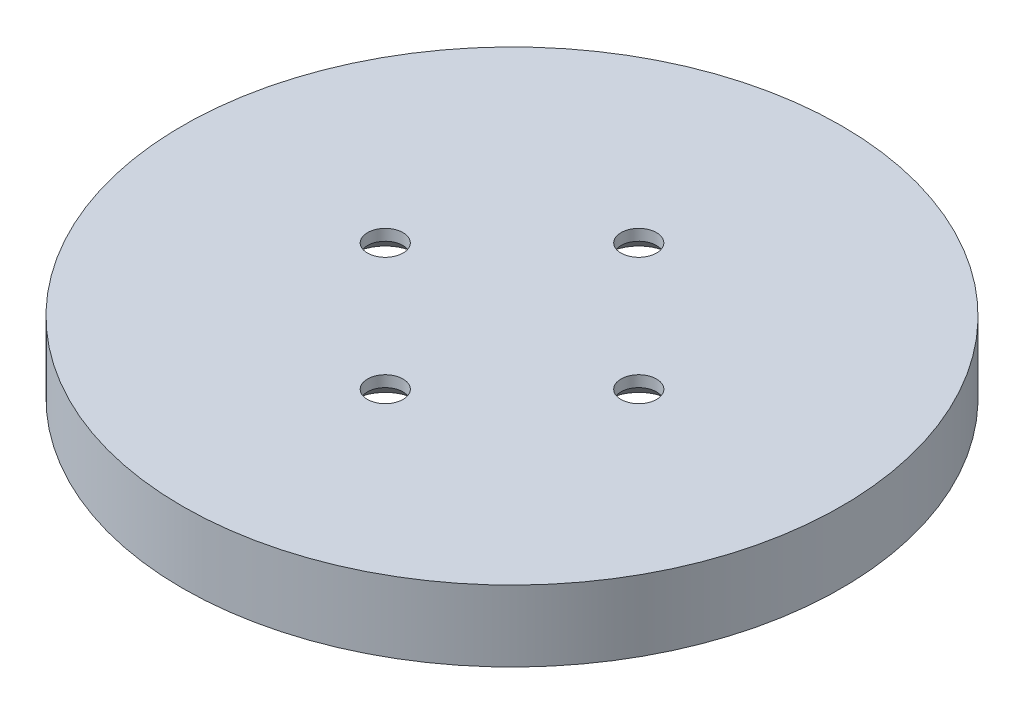
from build123d import *

# Parameters (mm, degrees)
SKETCH1_R                                    = 65
BOSS_EXTRUDE2_DEPTH                          = 30
SKETCH2_R                                    = 52.6
CUT_EXTRUDE1_DEPTH                           = 84
SKETCH4_R                                    = 52.6
BOSS_EXTRUDE3_DEPTH                          = 5
SKETCH5_W                                    = 16.2
SKETCH5_H                                    = 9.2
CUT_EXTRUDE2_DEPTH                           = 12
CUT_EXTRUDE3_DEPTH                           = 5.2
M6_CLEARANCE_HOLE1_D                         = 7
CUT_EXTRUDE4_START                           = -18
SKETCH11_R                                   = 65
CUT_EXTRUDE4_DEPTH                           = 18
SKETCH12_R                                   = 65
BOSS_EXTRUDE4_DEPTH                          = 5
CSK_FOR_M6_COUNTERSUNK_FLAT_HEAD_SCR_2_COUNT = 2
CSK_FOR_M6_COUNTERSUNK_FLAT_HEAD_SCR_2_PITCH = 35.355339059
CSK_FOR_M6_COUNTERSUNK_FLAT_HEAD_SCR_3_COUNT = 2
CSK_FOR_M6_COUNTERSUNK_FLAT_HEAD_SCR_3_PITCH = 50
CSK_FOR_M6_COUNTERSUNK_FLAT_HEAD_SCR_4_COUNT = 2
CSK_FOR_M6_COUNTERSUNK_FLAT_HEAD_SCR_4_PITCH = 50
CSK_FOR_M6_COUNTERSUNK_FLAT_HEAD_SCR_5_COUNT = 2
CSK_FOR_M6_COUNTERSUNK_FLAT_HEAD_SCR_5_PITCH = 35.355339059
CSK_FOR_M6_COUNTERSUNK_FLAT_HEAD_SCR_6_COUNT = 2
CSK_FOR_M6_COUNTERSUNK_FLAT_HEAD_SCR_6_PITCH = 35.355339059
CUT_EXTRUDE5_START                           = -3
SKETCH22_R                                   = 65
CUT_EXTRUDE5_DEPTH                           = 3


with BuildPart() as part:
    # Sketch1 → Boss-Extrude2 (new body)
    with BuildSketch(Plane(origin=(0, 0, 0), x_dir=(1, 0, 0), z_dir=(0, 1, 0))):
        with Locations(Location((0, 0, 0), (0, 0, 270))):
            Circle(SKETCH1_R)
    extrude(amount=BOSS_EXTRUDE2_DEPTH)

    # Sketch2 → Cut-Extrude1 (cut)
    with BuildSketch(Plane(origin=(0, 30, 0), x_dir=(1, 0, 0), z_dir=(0, 1, 0))):
        with Locations(Location((0, 0, 0), (0, 0, 270))):
            Circle(SKETCH2_R)
    extrude(amount=-CUT_EXTRUDE1_DEPTH, mode=Mode.SUBTRACT)

    # Sketch4 → Boss-Extrude3 (add)
    with BuildSketch(Plane(origin=(0, 30, 0), x_dir=(1, 0, 0), z_dir=(0, 1, 0))):
        with Locations(Location((0, 0, 0), (0, 0, 270))):
            Circle(SKETCH4_R)
    extrude(amount=-BOSS_EXTRUDE3_DEPTH)

    # Sketch5 → Cut-Extrude2 (cut)
    with BuildSketch(Plane.XZ):
        with Locations((-52.6, 0)):
            Rectangle(SKETCH5_W, SKETCH5_H)
        with Locations((52.6, 0)):
            Rectangle(SKETCH5_W, SKETCH5_H)
    extrude(amount=-CUT_EXTRUDE2_DEPTH, mode=Mode.SUBTRACT)

    # Sketch7 → Cut-Extrude3 (cut)
    with BuildSketch(Plane.XZ.offset(-12)):
        with BuildLine():
            Line((37.19381669, -37.19381669), (44.070308528, -44.070308528))
            ThreePointArc((44.070308528, -44.070308528), (57.580632973, -23.850679107), (62.324828018, 0))
            Line((62.324828018, 0), (52.6, 0))
            ThreePointArc((52.6, 0), (48.59606341, -20.129148542), (37.19381669, -37.19381669))
        make_face()
        with BuildLine():
            Line((-37.19381669, 37.19381669), (-44.070308528, 44.070308528))
            ThreePointArc((-44.070308528, 44.070308528), (-57.580632973, 23.850679107), (-62.324828018, 0))
            Line((-62.324828018, 0), (-52.6, 0))
            ThreePointArc((-52.6, 0), (-48.59606341, 20.129148542), (-37.19381669, 37.19381669))
        make_face()
    extrude(amount=CUT_EXTRUDE3_DEPTH, mode=Mode.SUBTRACT)

    # M6 Clearance Hole1 (through all)
    with Locations(Plane(origin=(0, 30, -25), x_dir=(0, 0, 1), z_dir=(0, 1, 0))):
        with Locations((0, 0), (25, -25), (25, 25), (50, 0)):
            Hole(M6_CLEARANCE_HOLE1_D / 2)

    # Sketch11 → Cut-Extrude4 (cut)
    with BuildSketch(Plane(origin=(0, 30, 0), x_dir=(1, 0, 0), z_dir=(0, 1, 0)).offset(CUT_EXTRUDE4_START)):
        with Locations(Location((0, 0, 0), (0, 0, 270))):
            Circle(SKETCH11_R)
    extrude(amount=CUT_EXTRUDE4_DEPTH, mode=Mode.SUBTRACT)

    # Sketch12 → Boss-Extrude4 (add)
    with BuildSketch(Plane(origin=(0, 12, 0), x_dir=(1, 0, 0), z_dir=(0, 1, 0))):
        with Locations(Location((0, 0, 0), (0, 0, 270))):
            Circle(SKETCH12_R)
    extrude(amount=BOSS_EXTRUDE4_DEPTH)

    # Sketch21 → CSK for M6 Countersunk Flat Head Screw3 (revolve, cut)
    with BuildSketch(Plane(origin=(25, 12, 0), x_dir=(0, 0, -1), z_dir=(1, 0, 0))):
        Polygon((0, 0), (0, 5), (3.5, 5), (3.5, 2.8), (6.3, 0), align=None)
    csk_for_m6_countersunk_flat_head_screw3 = revolve(axis=Axis((25, 5.65, 0), (0, 1, 0)), mode=Mode.SUBTRACT)

    # CSK for M6 Countersunk Flat Head Scr 2: CSK for M6 Countersunk Flat Head Screw3 ×2
    with Locations(*[Vector(-0.7071067811865476, 0, 0.7071067811865476) * (i * CSK_FOR_M6_COUNTERSUNK_FLAT_HEAD_SCR_2_PITCH) for i in range(1, CSK_FOR_M6_COUNTERSUNK_FLAT_HEAD_SCR_2_COUNT)]):
        add(csk_for_m6_countersunk_flat_head_screw3, mode=Mode.SUBTRACT)

    # CSK for M6 Countersunk Flat Head Scr 3: CSK for M6 Countersunk Flat Head Screw3 ×2
    with Locations(*[(-i * CSK_FOR_M6_COUNTERSUNK_FLAT_HEAD_SCR_3_PITCH, 0, 0) for i in range(1, CSK_FOR_M6_COUNTERSUNK_FLAT_HEAD_SCR_3_COUNT)]):
        add(csk_for_m6_countersunk_flat_head_screw3, mode=Mode.SUBTRACT)

    # CSK for M6 Countersunk Flat Head Scr 4: CSK for M6 Countersunk Flat Head Screw3 ×2
    with Locations(*[(-i * CSK_FOR_M6_COUNTERSUNK_FLAT_HEAD_SCR_4_PITCH, 0, 0) for i in range(1, CSK_FOR_M6_COUNTERSUNK_FLAT_HEAD_SCR_4_COUNT)]):
        add(csk_for_m6_countersunk_flat_head_screw3, mode=Mode.SUBTRACT)

    # CSK for M6 Countersunk Flat Head Scr 5: CSK for M6 Countersunk Flat Head Screw3 ×2
    with Locations(*[Vector(-0.7071067811865476, 0, 0.7071067811865476) * (i * CSK_FOR_M6_COUNTERSUNK_FLAT_HEAD_SCR_5_PITCH) for i in range(1, CSK_FOR_M6_COUNTERSUNK_FLAT_HEAD_SCR_5_COUNT)]):
        add(csk_for_m6_countersunk_flat_head_screw3, mode=Mode.SUBTRACT)

    # CSK for M6 Countersunk Flat Head Scr 6: CSK for M6 Countersunk Flat Head Screw3 ×2
    with Locations(*[Vector(-0.7071067811865476, 0, -0.7071067811865476) * (i * CSK_FOR_M6_COUNTERSUNK_FLAT_HEAD_SCR_6_PITCH) for i in range(1, CSK_FOR_M6_COUNTERSUNK_FLAT_HEAD_SCR_6_COUNT)]):
        add(csk_for_m6_countersunk_flat_head_screw3, mode=Mode.SUBTRACT)

    # Sketch22 → Cut-Extrude5 (cut)
    with BuildSketch(Plane.XZ.offset(CUT_EXTRUDE5_START)):
        with Locations(Location((0, 0, 0), (0, 0, 270))):
            Circle(SKETCH22_R)
        with BuildLine():
            Line((-52.39847326, 4.6), (-60.7, 4.6))
            Line((-60.7, 4.6), (-60.7, -4.6))
            Line((-60.7, -4.6), (-52.39847326, -4.6))
            ThreePointArc((-52.39847326, -4.6), (0, -52.6), (52.39847326, -4.6))
            Line((52.39847326, -4.6), (60.7, -4.6))
            Line((60.7, -4.6), (60.7, 4.6))
            Line((60.7, 4.6), (52.39847326, 4.6))
            ThreePointArc((52.39847326, 4.6), (0, 52.6), (-52.39847326, 4.6))
        make_face(mode=Mode.SUBTRACT)
    extrude(amount=CUT_EXTRUDE5_DEPTH, mode=Mode.SUBTRACT)


solid = part.part
